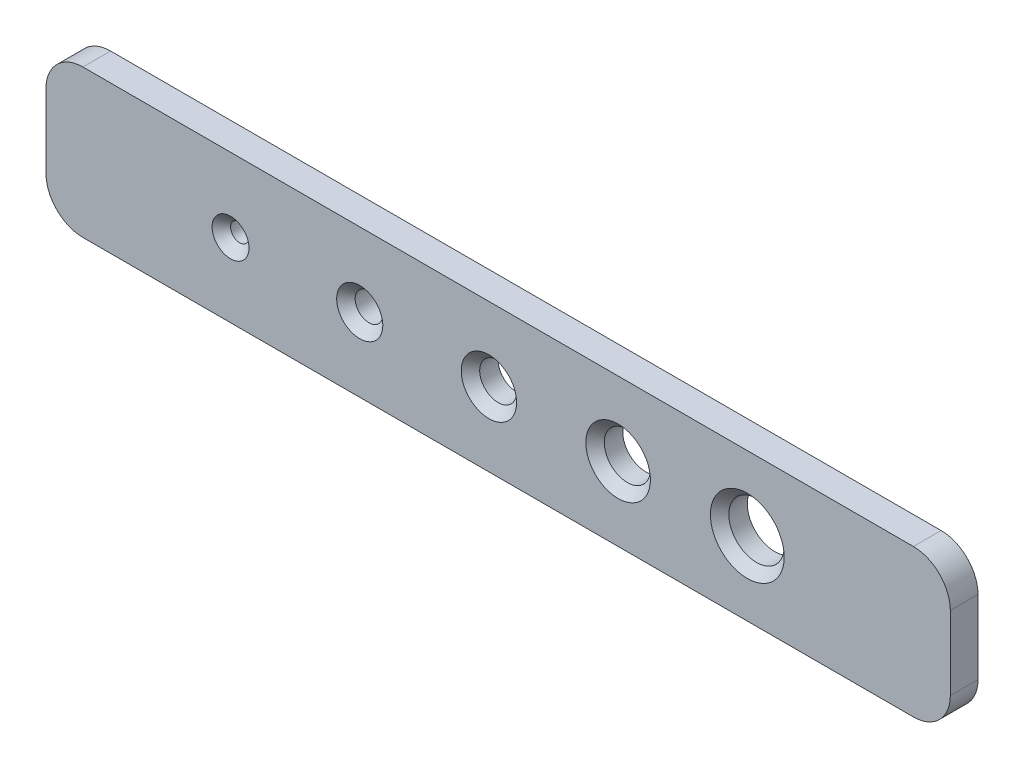
from build123d import *

# Parameters (mm, degrees)
SKETCH2_W                                        = 155.575
SKETCH2_H                                        = 25.4
BOSS_EXTRUDE2_DEPTH                              = 4.7625
FILLET1_R                                        = 6.35
SKETCH3_R                                        = 1.5875
SKETCH3_R_2                                      = 2.38125
SKETCH3_R_3                                      = 3.175
SKETCH3_R_4                                      = 3.96875
SKETCH3_R_5                                      = 4.7625
CUT_EXTRUDE1_DEPTH                               = 158.706759624
CSK_FOR_M10_FLAT_HEAD_MACHINE_SCREW3_D           = 3.175
CSK_FOR_M10_FLAT_HEAD_MACHINE_SCREW3_CSINK_D     = 6.35
CSK_FOR_M10_FLAT_HEAD_MACHINE_SCREW3_CSINK_ANGLE = 90
CSK_FOR_M10_FLAT_HEAD_MACHINE_SCREW4_D           = 4.7625
CSK_FOR_M10_FLAT_HEAD_MACHINE_SCREW4_CSINK_D     = 7.9375
CSK_FOR_M10_FLAT_HEAD_MACHINE_SCREW4_CSINK_ANGLE = 90
CSK_FOR_M10_FLAT_HEAD_MACHINE_SCREW5_D           = 6.35
CSK_FOR_M10_FLAT_HEAD_MACHINE_SCREW5_CSINK_D     = 9.525
CSK_FOR_M10_FLAT_HEAD_MACHINE_SCREW5_CSINK_ANGLE = 90


with BuildPart() as part:
    # Sketch2 → Boss-Extrude2 (new body)
    with BuildSketch(Plane.XY):
        with Locations((77.7875, 12.7)):
            Rectangle(SKETCH2_W, SKETCH2_H)
    extrude(amount=BOSS_EXTRUDE2_DEPTH)

    # Fillet1
    fillet1_edges = [part.edges().sort_by_distance(p)[0] for p in [
        (0, 25.4, 2.38125),
        (155.575, 25.4, 2.38125),
        (155.575, 0, 2.38125),
        (0, 0, 2.38125),
    ]]
    fillet(fillet1_edges, radius=FILLET1_R)

    # Sketch3 → Cut-Extrude1 (cut, through all)
    with BuildSketch(Plane.XY.offset(4.7625)):
        with Locations((31.75, 12.7)):
            Circle(SKETCH3_R)
        with Locations((53.975, 12.7)):
            Circle(SKETCH3_R_2)
        with Locations((76.2, 12.7)):
            Circle(SKETCH3_R_3)
        with Locations((98.425, 12.7)):
            Circle(SKETCH3_R_4)
        with Locations((120.65, 12.7)):
            Circle(SKETCH3_R_5)
    extrude(amount=-CUT_EXTRUDE1_DEPTH, mode=Mode.SUBTRACT)

    # CSK for M10 Flat Head Machine Screw3 (through all)
    with Locations(Plane(origin=(31.75, 12.7, 4.7625), x_dir=(1, 0, 0), z_dir=(0, 0, 1))):
        with Locations((0, 0)):
            CounterSinkHole(CSK_FOR_M10_FLAT_HEAD_MACHINE_SCREW3_D / 2, CSK_FOR_M10_FLAT_HEAD_MACHINE_SCREW3_CSINK_D / 2, counter_sink_angle=CSK_FOR_M10_FLAT_HEAD_MACHINE_SCREW3_CSINK_ANGLE)

    # CSK for M10 Flat Head Machine Screw4 (through all)
    with Locations(Plane(origin=(53.975, 12.7, 4.7625), x_dir=(1, 0, 0), z_dir=(0, 0, 1))):
        with Locations((0, 0)):
            CounterSinkHole(CSK_FOR_M10_FLAT_HEAD_MACHINE_SCREW4_D / 2, CSK_FOR_M10_FLAT_HEAD_MACHINE_SCREW4_CSINK_D / 2, counter_sink_angle=CSK_FOR_M10_FLAT_HEAD_MACHINE_SCREW4_CSINK_ANGLE)

    # CSK for M10 Flat Head Machine Screw5 (through all)
    with Locations(Plane(origin=(76.2, 12.7, 4.7625), x_dir=(1, 0, 0), z_dir=(0, 0, 1))):
        with Locations((0, 0)):
            CounterSinkHole(CSK_FOR_M10_FLAT_HEAD_MACHINE_SCREW5_D / 2, CSK_FOR_M10_FLAT_HEAD_MACHINE_SCREW5_CSINK_D / 2, counter_sink_angle=CSK_FOR_M10_FLAT_HEAD_MACHINE_SCREW5_CSINK_ANGLE)

    # Sketch14 → CSK for M10 Flat Head Machine Screw6 (revolve, cut)
    with BuildSketch(Plane(origin=(98.425, 12.7, 4.7625), x_dir=(0, -1, 0), z_dir=(1, 0, 0))):
        Polygon((0, 0), (0, 4.7625), (3.96875, 4.7625), (3.96875, 1.5875), (5.55625, 0), align=None)
    revolve(axis=Axis((98.425, 12.7, 11.1125), (0, 0, -1)), mode=Mode.SUBTRACT)

    # Sketch15 → CSK for M10 Flat Head Machine Screw7 (revolve, cut)
    with BuildSketch(Plane(origin=(120.65, 12.7, 4.7625), x_dir=(0, -1, 0), z_dir=(1, 0, 0))):
        Polygon((0, 0), (0, 4.7625), (4.7625, 4.7625), (4.7625, 1.5875), (6.35, 0), align=None)
    revolve(axis=Axis((120.65, 12.7, 11.1125), (0, 0, -1)), mode=Mode.SUBTRACT)


solid = part.part
